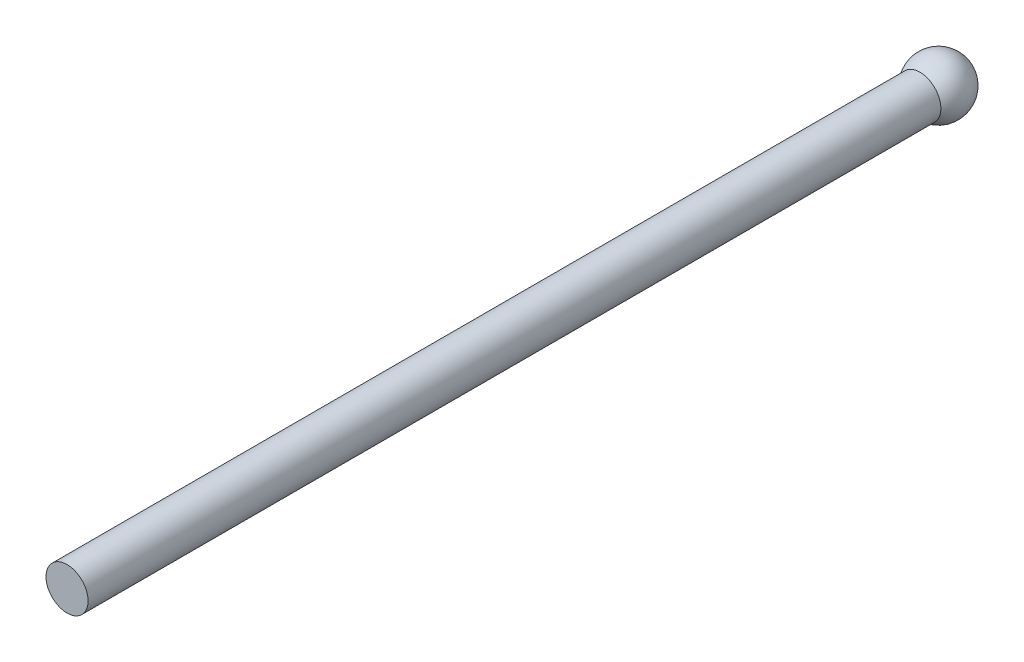
from build123d import *

# Parameters (mm, degrees)
SKETCH1_R           = 7.5
BOSS_EXTRUDE1_DEPTH = 310.58


with BuildPart() as part:
    # Sketch1 → Boss-Extrude1 (new body)
    with BuildSketch(Plane.XY):
        Circle(SKETCH1_R)
    extrude(amount=BOSS_EXTRUDE1_DEPTH)

    # Sketch2 → Revolve1 (revolve)
    with BuildSketch(Plane(origin=(0, 0, 0), x_dir=(1, 0, 0), z_dir=(0, 1, 0))):
        with BuildLine():
            Line((-7.5, -6.614378278), (0, -6.614378278))
            Line((0, -6.614378278), (0, 10))
            ThreePointArc((0, 10), (-9.114378278, 4.114378278), (-7.5, -6.614378278))
        make_face()
    revolve(axis=Axis((0, 0, 0), (0, 0, -1)))


solid = part.part
